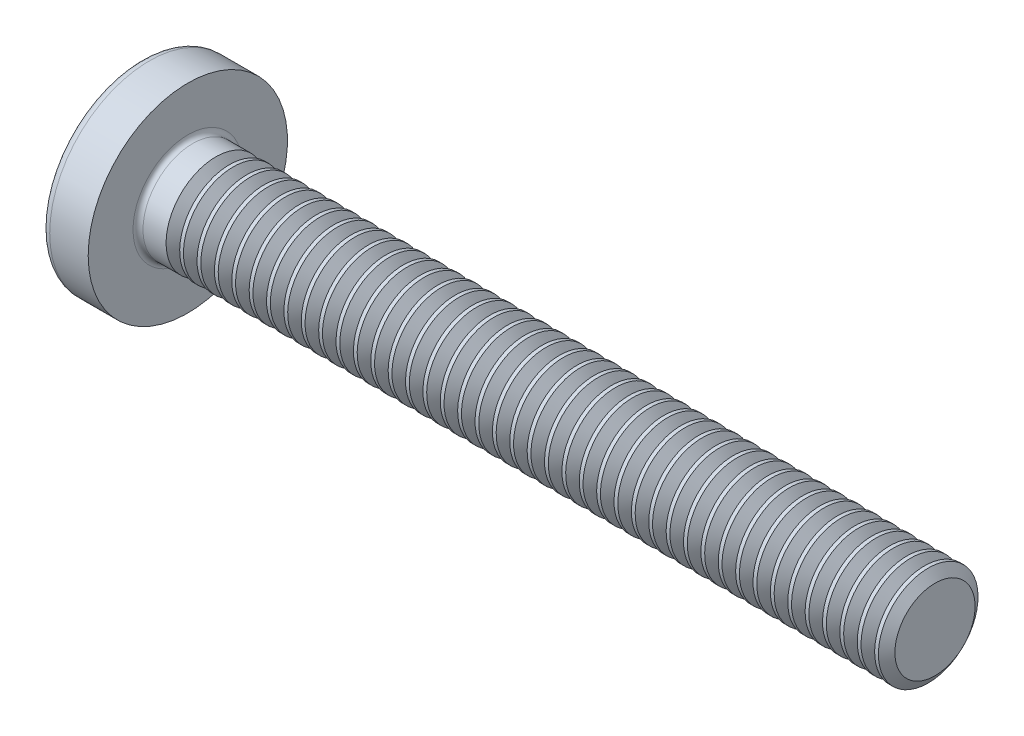
from build123d import *

# Parameters (mm, degrees)
FILLET1_R       = 0.2
RECPAT_COUNT    = 2
RECPAT_ANGLE    = 90
THDSCHPAT_COUNT = 42
THDSCHPAT_PITCH = 0.697560976


with BuildPart() as part:
    # BodySke → Base-Revolve (revolve)
    with BuildSketch(Plane.XY, mode=Mode.PRIVATE) as base_revolve_sk:
        with BuildLine():
            Line((3.1, 2), (3.1, 4))
            Line((3.1, 4), (1.555305874, 4))
            ThreePointArc((1.555305874, 4), (1.392873227, 3.961271902), (1.265388955, 3.853420195))
            ThreePointArc((1.265388955, 3.853420195), (0.324444487, 2.027933456), (0, 0))
            Line((0, 0), (33.1, 0))
            Line((33.1, 0), (33.1, 2))
            Line((33.1, 2), (3.1, 2))
        make_face()
    revolve(base_revolve_sk.sketch.rotate(Axis((1.555305874, 0, 0), (1, 0, 0)), 90), axis=Axis((1.555305874, 0, 0), (1, 0, 0)))

    # Fillet1
    fillet1_edges = [part.edges().sort_by_distance(p)[0] for p in [
        (3.1, 0, -2),
    ]]
    fillet(fillet1_edges, radius=FILLET1_R)

    # Sketch3 → Recess section 0
    with BuildSketch(Plane(origin=(0, 0, 0), x_dir=(0, 0, -1), z_dir=(1, 0, 0))):
        with BuildLine():
            Line((0.515, -2.15), (-0.515, -2.15))
            Line((-0.515, -2.15), (-0.515, 2.15))
            Line((-0.515, 2.15), (0.515, 2.15))
            Line((0.515, 2.15), (0.515, -2.15))
        make_face()
    # Sketch4 → Recess section 1
    with BuildSketch(Plane(origin=(2.34, 0, 0), x_dir=(0, 0, -1), z_dir=(1, 0, 0))):
        with BuildLine():
            Line((0.515, -0.983319232), (-0.515, -0.983319232))
            Line((-0.515, -0.983319232), (-0.515, 0.983319232))
            Line((-0.515, 0.983319232), (0.515, 0.983319232))
            Line((0.515, 0.983319232), (0.515, -0.983319232))
        make_face()
    recess = loft(mode=Mode.SUBTRACT)

    # RecPat: Recess ×2 about axis
    recpat_axis = Axis((0, 0, 0), (1, 0, 0))
    for i in range(1, RECPAT_COUNT):
        add(recess.rotate(recpat_axis, i * RECPAT_ANGLE / (RECPAT_COUNT - 1)), mode=Mode.SUBTRACT)

    # RecCorSke → RecessCore (revolve, cut)
    with BuildSketch(Plane.XY, mode=Mode.PRIVATE) as recesscore_sk:
        Polygon((0, 0), (0, 1.01462874), (2.34, 0.851), (2.616506661, 0), align=None)
    revolve(recesscore_sk.sketch.rotate(Axis((-3.175, 0, 0), (1, 0, 0)), 14.547591759), axis=Axis((-3.175, 0, 0), (1, 0, 0)), mode=Mode.SUBTRACT)

    # ThdSchSke → ThreadSchematic (revolve, cut)
    with BuildSketch(Plane.XY, mode=Mode.PRIVATE) as threadschematic_sk:
        Polygon((4.5, -1.61), (4.22691906, -2), (4.22691906, -2.5), (4.77308094, -2.5), (4.77308094, -2), align=None)
    threadschematic = revolve(threadschematic_sk.sketch.rotate(Axis((-3.175, 0, 0), (1, 0, 0)), 270), axis=Axis((-3.175, 0, 0), (1, 0, 0)), mode=Mode.SUBTRACT)

    # ThdSchPat: ThreadSchematic ×42
    with Locations(*[(i * THDSCHPAT_PITCH, 0, 0) for i in range(1, THDSCHPAT_COUNT)]):
        add(threadschematic, mode=Mode.SUBTRACT)


solid = part.part
